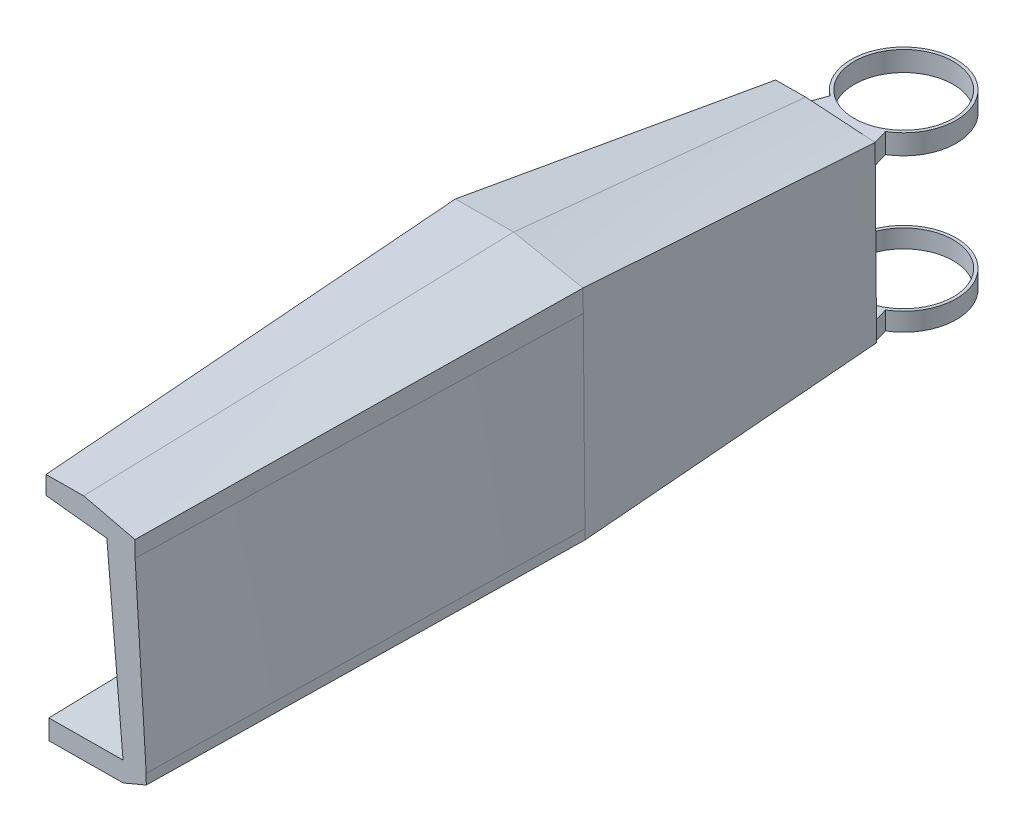
from build123d import *

# Parameters (mm, degrees)
SKETCH4_R           = 13.33935295
BOSS_EXTRUDE1_DEPTH = 5.387848
BOSS_EXTRUDE2_START = -41.145202
SKETCH4_2_R         = 13.33935295
BOSS_EXTRUDE2_DEPTH = 4.89559


with BuildPart() as part:
    # Sketch1 → Loft1 section 0
    with BuildSketch(Plane.XY.offset(238.871252)):
        with BuildLine():
            Line((117.449346, 305.101244), (133.79958, 303.314354))
            Line((133.79958, 303.314354), (138.168888, 253.734316))
            Line((138.168888, 253.734316), (118.163594, 253.574042))
            Line((118.163594, 253.574042), (118.210076, 248.25706))
            Line((118.210076, 248.25706), (138.215116, 248.41708))
            Line((138.215116, 248.41708), (144.422368, 251.041916))
            Line((144.422368, 251.041916), (144.398492, 253.7841))
            Line((144.398492, 253.7841), (141.414246, 302.436784))
            Line((141.414246, 302.436784), (141.376146, 306.803552))
            Line((141.376146, 306.803552), (127.531876, 310.087518))
            Line((127.531876, 310.087518), (117.406674, 310.006492))
            Line((117.406674, 310.006492), (117.449346, 305.101244))
        make_face()
    # Sketch2 → Loft1 section 1
    with BuildSketch(Plane.XY.offset(123.421394)):
        with BuildLine():
            Line((112.248188, 313.980322), (127.943864, 314.106052))
            Line((127.943864, 314.106052), (146.665442, 310.414162))
            Line((146.665442, 310.414162), (146.717258, 304.488342))
            Line((146.717258, 304.488342), (147.153376, 254.497586))
            Line((147.153376, 254.497586), (147.176236, 251.879608))
            Line((147.176236, 251.879608), (136.055354, 248.87809))
            Line((136.055354, 248.87809), (116.05006, 248.717816))
            Line((116.05006, 248.717816), (116.002054, 254.247904))
            Line((116.002054, 254.247904), (136.007094, 254.408178))
            Line((136.007094, 254.408178), (131.213352, 307.596286))
            Line((131.213352, 307.596286), (112.305084, 307.444902))
            Line((112.305084, 307.444902), (112.248188, 313.980322))
        make_face()
    loft()

    # Sketch2<3> → Loft2 section 0
    with BuildSketch(Plane.XY.offset(123.421394)):
        with BuildLine():
            Line((112.248188, 313.980322), (127.943864, 314.106052))
            Line((127.943864, 314.106052), (146.665442, 310.414162))
            Line((146.665442, 310.414162), (146.717258, 304.488342))
            Line((146.717258, 304.488342), (147.153376, 254.497586))
            Line((147.153376, 254.497586), (147.176236, 251.879608))
            Line((147.176236, 251.879608), (136.055354, 248.87809))
            Line((136.055354, 248.87809), (116.05006, 248.717816))
            Line((116.05006, 248.717816), (116.002054, 254.247904))
            Line((116.002054, 254.247904), (136.007094, 254.408178))
            Line((136.007094, 254.408178), (131.213352, 307.596286))
            Line((131.213352, 307.596286), (112.305084, 307.444902))
            Line((112.305084, 307.444902), (112.248188, 313.980322))
        make_face()
    # Sketch3 → Loft2 section 1
    with BuildSketch(Plane.XY.offset(44.31157)):
        with BuildLine():
            Line((119.47779, 299.154342), (119.419878, 305.769518))
            Line((119.419878, 305.769518), (127.526288, 305.834288))
            Line((127.526288, 305.834288), (146.226276, 304.60696))
            Line((146.226276, 304.60696), (146.271996, 299.368972))
            Line((146.271996, 299.368972), (146.588226, 263.119108))
            Line((146.588226, 263.119108), (146.632168, 258.073906))
            Line((146.632168, 258.073906), (127.955548, 256.62763))
            Line((127.955548, 256.62763), (121.519188, 256.576068))
            Line((121.519188, 256.576068), (121.463816, 262.91794))
            Line((121.463816, 262.91794), (127.900176, 262.969502))
            Line((127.900176, 262.969502), (127.583946, 299.219112))
            Line((127.583946, 299.219112), (119.47779, 299.154342))
        make_face()
    loft()

    # Sketch4 → Boss-Extrude1 (add)
    with BuildSketch(Plane(origin=(0, 299.219112, 0), x_dir=(1, 0, 0), z_dir=(0, 1, 0))):
        with BuildLine():
            Line((146.226276, -44.31157), (145.07845, -40.361616))
            ThreePointArc((145.07845, -40.361616), (138.59477889, -14.045079031), (129.276856, -39.496492))
            Line((129.276856, -39.496492), (127.526288, -44.31157))
            Line((127.526288, -44.31157), (146.226276, -44.31157))
        make_face()
        with Locations(Location((137.820198563, -28.192881954, 0), (0, 0, 270))):
            Circle(SKETCH4_R, mode=Mode.SUBTRACT)
    extrude(amount=BOSS_EXTRUDE1_DEPTH)

    # Sketch4<2> → Boss-Extrude2 (add)
    with BuildSketch(Plane(origin=(0, 299.219112, 0), x_dir=(1, 0, 0), z_dir=(0, 1, 0)).offset(BOSS_EXTRUDE2_START)):
        with BuildLine():
            Line((146.226276, -44.31157), (145.07845, -40.361616))
            ThreePointArc((145.07845, -40.361616), (138.59477889, -14.045079031), (129.276856, -39.496492))
            Line((129.276856, -39.496492), (127.526288, -44.31157))
            Line((127.526288, -44.31157), (146.226276, -44.31157))
        make_face()
        with Locations(Location((137.820198563, -28.192881954, 0), (0, 0, 270))):
            Circle(SKETCH4_2_R, mode=Mode.SUBTRACT)
    extrude(amount=BOSS_EXTRUDE2_DEPTH)


solid = part.part
